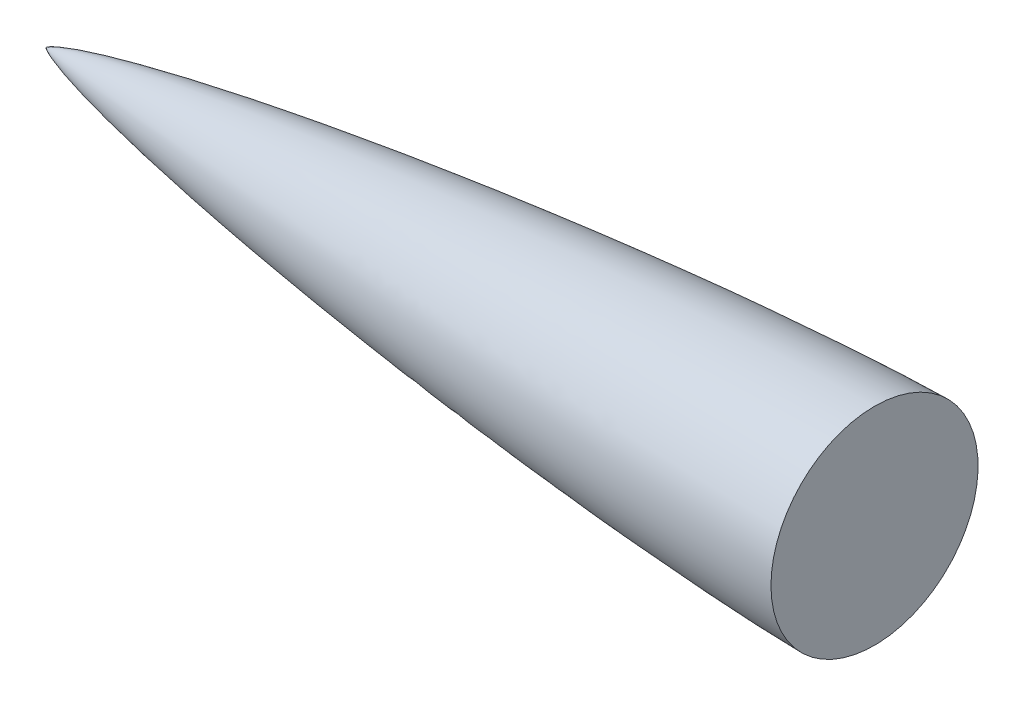
from build123d import *


with BuildPart() as part:
    # Sketch11 → Revolve10 (revolve)
    with BuildSketch(Plane.XY):
        with BuildLine():
            Line((0, 0), (24, 0))
            Line((24, 0), (24, 3))
            add(Edge.make_bspline(
                [(0, 0), (0.002082938, 0.003592282), (0.006955612, 0.009504493), (0.016121466, 0.016453157), (0.029425432, 0.025880744), (0.046315451, 0.036187846), (0.071790685, 0.050358552), (0.114958349, 0.071742967), (0.190618213, 0.104930537), (0.328433942, 0.157905783), (0.581046914, 0.242053237), (1.006672163, 0.364236676), (1.762565678, 0.55209695), (2.820881731, 0.777342197), (4.124157138, 1.021320027), (5.605976983, 1.268903242), (7.091200989, 1.494899748), (8.579036911, 1.702995624), (10.068944452, 1.895604051), (11.560610087, 2.074085365), (13.053795698, 2.239339594), (14.548348012, 2.391729739), (16.044148913, 2.531357565), (17.54112069, 2.657789619), (19.039208284, 2.770360149), (20.538382219, 2.867346425), (21.965905642, 2.942651696), (23.019084908, 2.982281147), (23.697255753, 2.998185314), (24, 3)],
                knots=[0, 0, 0, 0, 0, 0.00068333, 0.001271578, 0.001867288, 0.002702823, 0.003938438, 0.006082376, 0.009807648, 0.01632665, 0.028281813, 0.049985868, 0.082825913, 0.144771647, 0.206717369, 0.268663099, 0.330608828, 0.392554557, 0.454500287, 0.516446017, 0.578391746, 0.640337474, 0.702283204, 0.764228933, 0.826174663, 0.888120391, 0.950066122, 1, 1, 1, 1, 1], degree=4))
        make_face()
    revolve(axis=Axis((0, 0, 0), (1, 0, 0)))


solid = part.part
